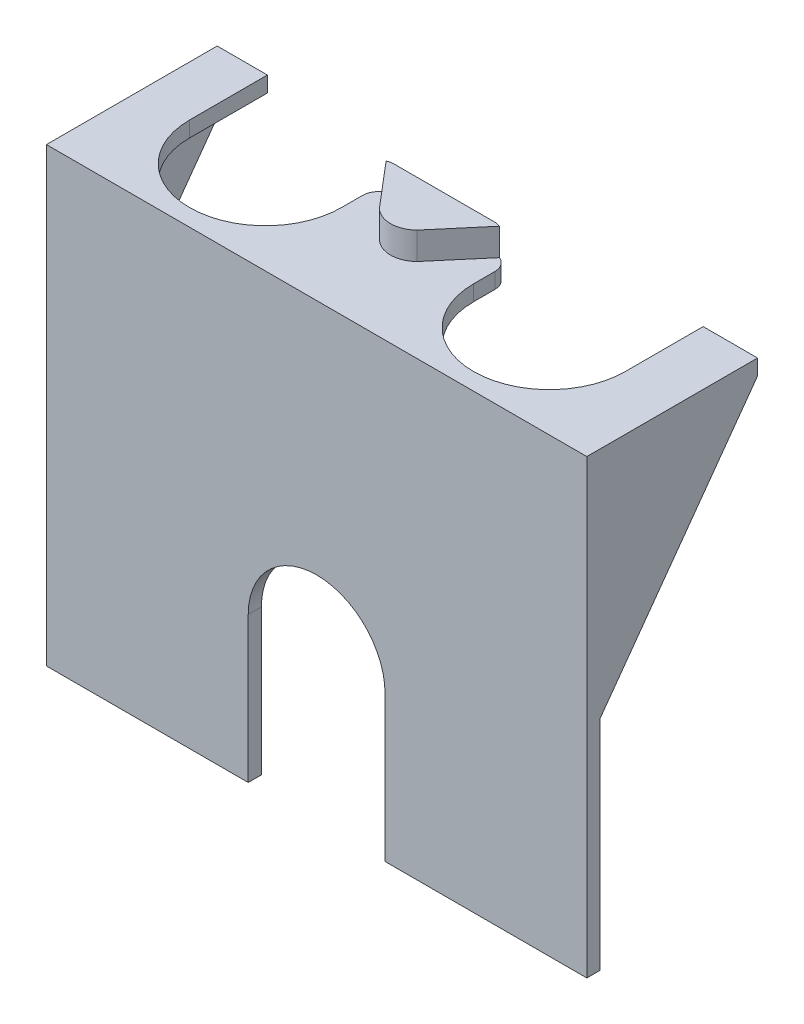
from build123d import *

# Parameters (mm, degrees)
SKETCH1_W                = 138.816596539
SKETCH1_H                = 51.704152624
BOSS_EXTRUDE1_DEPTH      = 4
SKETCH2_R                = 19.5
CUT_EXTRUDE1_DEPTH       = 4
SKETCH3_W                = 39
SKETCH3_H                = 25.518890855
CUT_EXTRUDE2_DEPTH       = 4
SKETCH4_W                = 138.816596539
SKETCH4_H                = 5.527763413
CUT_EXTRUDE3_DEPTH       = 4
CUT_EXTRUDE4_DEPTH       = 4
BOSS_EXTRUDE2_DEPTH      = 7
CUT_EXTRUDE6_DEPTH       = 10
CUT_EXTRUDE6_DEPTH_BACK  = 1
SKETCH8_W                = 41.210335228
SKETCH8_H                = 18.724016431
FILLET1_R                = 4
SKETCH9_W                = 159.262648619
SKETCH9_H                = 8.218574615
CUT_EXTRUDE7_DEPTH       = 13
SKETCH10_W               = 138.816596539
SKETCH10_H               = 3.381053597
BOSS_EXTRUDE3_DEPTH      = 112
CUT_EXTRUDE8_DEPTH       = 6
BOSS_EXTRUDE4_DEPTH      = 5
BOSS_EXTRUDE5_DEPTH      = 5
BOSS_EXTRUDE6_DEPTH      = 3
BOSS_EXTRUDE6_DEPTH_BACK = 3


with BuildPart() as part:
    # Sketch1 → Boss-Extrude1 (new body)
    with BuildSketch(Plane(origin=(0, 0, 0), x_dir=(1, 0, 0), z_dir=(0, 1, 0))):
        with Locations((69.40829827, 25.852076312)):
            Rectangle(SKETCH1_W, SKETCH1_H)
    extrude(amount=BOSS_EXTRUDE1_DEPTH)

    # Sketch2 → Cut-Extrude1 (cut)
    with BuildSketch(Plane(origin=(0, 4, 0), x_dir=(1, 0, 0), z_dir=(0, 1, 0))):
        with Locations(Location((32.40871363, 26.185261769, 0), (0, 0, 270))):
            Circle(SKETCH2_R)
        with Locations(Location((105.33778471, 26.185261769, 0), (0, 0, 270))):
            Circle(SKETCH2_R)
    extrude(amount=-CUT_EXTRUDE1_DEPTH, mode=Mode.SUBTRACT)

    # Sketch3 → Cut-Extrude2 (cut)
    with BuildSketch(Plane(origin=(0, 4, 0), x_dir=(1, 0, 0), z_dir=(0, 1, 0))):
        with Locations((32.40871363, 38.944707197)):
            Rectangle(SKETCH3_W, SKETCH3_H)
        with Locations((105.33778471, 38.944707197)):
            Rectangle(SKETCH3_W, SKETCH3_H)
    extrude(amount=-CUT_EXTRUDE2_DEPTH, mode=Mode.SUBTRACT)

    # Sketch4 → Cut-Extrude3 (cut)
    with BuildSketch(Plane(origin=(0, 4, 0), x_dir=(1, 0, 0), z_dir=(0, 1, 0))):
        with Locations((69.40829827, 48.940270918)):
            Rectangle(SKETCH4_W, SKETCH4_H)
    extrude(amount=-CUT_EXTRUDE3_DEPTH, mode=Mode.SUBTRACT)

    # Sketch5 → Cut-Extrude4 (cut)
    with BuildSketch(Plane(origin=(0, 4, 0), x_dir=(1, 0, 0), z_dir=(0, 1, 0))):
        Polygon((51.928250722, 38.363055383), (49.904010148, 40.387295957), (49.904010148, 49.123987915), (88.976343822, 49.123987915), (88.23099636, 41.297839561), (87.953832157, 40.819568311), (85.857321802, 38.348253507), (84.416556547, 36.649914887), (53.389948025, 36.649914887), align=None)
    extrude(amount=-CUT_EXTRUDE4_DEPTH, mode=Mode.SUBTRACT)

    # Sketch6 → Boss-Extrude2 (add)
    with BuildSketch(Plane(origin=(0, 4, 0), x_dir=(1, 0, 0), z_dir=(0, 1, 0))):
        with BuildLine():
            Line((53.27008085, 36.472479648), (84.296689371, 36.472479648))
            Line((84.296689371, 36.472479648), (73.621100147, 23.890682137))
            ThreePointArc((73.621100147, 23.890682137), (68.737776852, 21.92042398), (63.891562932, 23.980272094))
            Line((63.891562932, 23.980272094), (53.27008085, 36.472479648))
        make_face()
    extrude(amount=BOSS_EXTRUDE2_DEPTH)

    # Sketch8 → Cut-Extrude6 (cut, two sides: drawn at the far end of the back side and taken through both)
    with BuildSketch(Plane(origin=(0, 0, -36.649914887), x_dir=(-1, 0, 0), z_dir=(0, 0, -1)).offset(-CUT_EXTRUDE6_DEPTH_BACK)):
        with Locations((-66.917709276, 5.20508787)):
            Rectangle(SKETCH8_W, SKETCH8_H)
    extrude(amount=CUT_EXTRUDE6_DEPTH + CUT_EXTRUDE6_DEPTH_BACK, mode=Mode.SUBTRACT)

    # Fillet1
    fillet1_edges = [part.edges().sort_by_distance(p)[0] for p in [
        (85.83778471, 2, -35.649914887),
        (51.90871363, 2, -35.649914887),
    ]]
    fillet(fillet1_edges, radius=FILLET1_R)

    # Sketch9 → Cut-Extrude7 (cut)
    with BuildSketch(Plane(origin=(0, 4, 0), x_dir=(1, 0, 0), z_dir=(0, 1, 0))):
        with Locations((71.074225557, -1.789652878)):
            Rectangle(SKETCH9_W, SKETCH9_H)
    extrude(amount=-CUT_EXTRUDE7_DEPTH, mode=Mode.SUBTRACT)

    # Sketch10 → Boss-Extrude3 (add)
    with BuildSketch(Plane(origin=(0, 0, 0), x_dir=(-1, 0, 0), z_dir=(0, -1, 0))):
        with Locations((-69.40829827, 4.010161229)):
            Rectangle(SKETCH10_W, SKETCH10_H)
    extrude(amount=BOSS_EXTRUDE3_DEPTH)

    # Sketch11 → Cut-Extrude8 (cut)
    with BuildSketch(Plane(origin=(0, 0, -5.700688027), x_dir=(-1, 0, 0), z_dir=(0, 0, -1))):
        with BuildLine():
            Line((-51.833864247, -74.608061362), (-51.833864247, -112))
            Line((-51.833864247, -112), (-86.982732292, -112))
            Line((-86.982732292, -112), (-86.982732292, -74.608061362))
            ThreePointArc((-86.982732292, -74.608061362), (-69.40829827, -57.033627339), (-51.833864247, -74.608061362))
        make_face()
    extrude(amount=-CUT_EXTRUDE8_DEPTH, mode=Mode.SUBTRACT)

    # Sketch12 → Boss-Extrude4 (add)
    with BuildSketch(Plane.ZY):
        Polygon((-46.176389211, 0), (-5.700688027, 0), (-5.700688027, -56), align=None)
    extrude(amount=-BOSS_EXTRUDE4_DEPTH)

    # Sketch13 → Boss-Extrude5 (add)
    with BuildSketch(Plane(origin=(138.816596539, 0, 0), x_dir=(0, 0, -1), z_dir=(1, 0, 0))):
        Polygon((5.700688027, 0), (46.176389211, 0), (5.700688027, -56), align=None)
    extrude(amount=-BOSS_EXTRUDE5_DEPTH)

    # Sketch14 → Boss-Extrude6 (add, two sides: drawn at the far end of the back side and taken through both)
    with BuildSketch(Plane(origin=(69, 0, 0), x_dir=(0, 0, -1), z_dir=(1, 0, 0)).offset(-BOSS_EXTRUDE6_DEPTH_BACK)):
        Polygon((5.700688027, 0), (35.649914887, 0), (5.700688027, -41.436137117), align=None)
    extrude(amount=BOSS_EXTRUDE6_DEPTH + BOSS_EXTRUDE6_DEPTH_BACK)


solid = part.part
